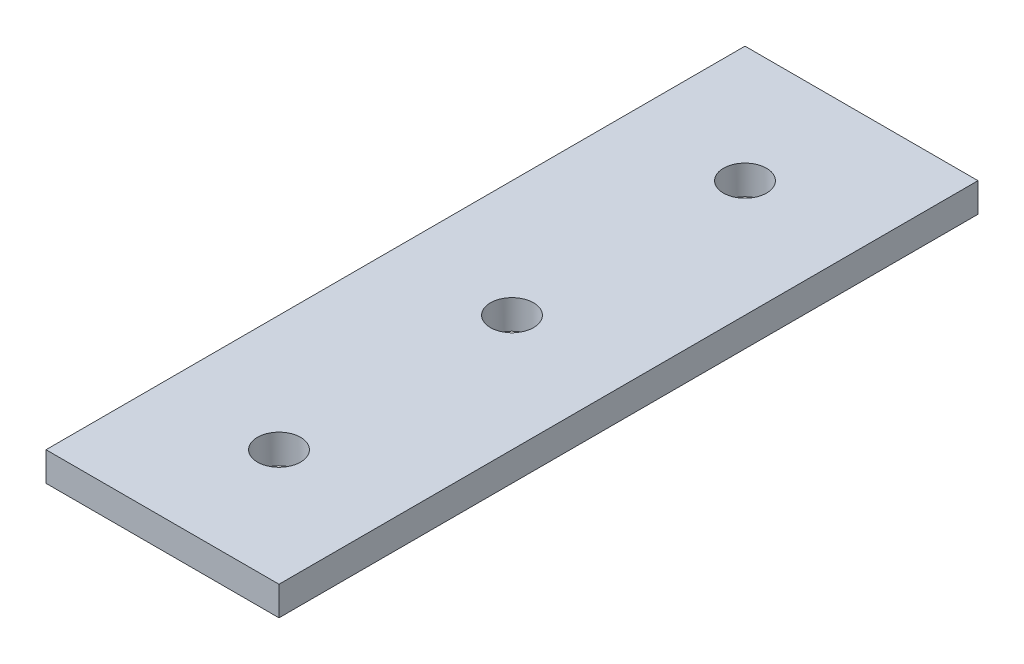
from build123d import *

# Parameters (mm, degrees)
SKETCH1_W               = 25.4
SKETCH1_H               = 76.2
BOSS_EXTRUDE1_DEPTH     = 1.5875
CUT_EXTRUDE1_DEPTH      = 41.286233691
CUT_EXTRUDE1_DEPTH_BACK = 41.286233691
SKETCH2_R               = 2.3495


with BuildPart() as part:
    # Sketch1 → Boss-Extrude1 (new, symmetric)
    with BuildSketch(Plane(origin=(0, 0, 0), x_dir=(1, 0, 0), z_dir=(0, 1, 0))):
        Rectangle(SKETCH1_W, SKETCH1_H)
    extrude(amount=BOSS_EXTRUDE1_DEPTH, both=True)

    # Sketch2 → Cut-Extrude1 (cut, two sides: drawn at the far end of the back side and taken through both)
    with BuildSketch(Plane(origin=(0, 1.5875, 0), x_dir=(1, 0, 0), z_dir=(0, 1, 0)).offset(-CUT_EXTRUDE1_DEPTH_BACK)):
        with Locations(Location((0, -25.4, 0), (0, 0, 270))):
            Circle(SKETCH2_R)
        with Locations(Location((0, 0, 0), (0, 0, 270))):
            Circle(SKETCH2_R)
        with Locations(Location((0, 25.4, 0), (0, 0, 270))):
            Circle(SKETCH2_R)
    extrude(amount=CUT_EXTRUDE1_DEPTH + CUT_EXTRUDE1_DEPTH_BACK, mode=Mode.SUBTRACT)


solid = part.part
